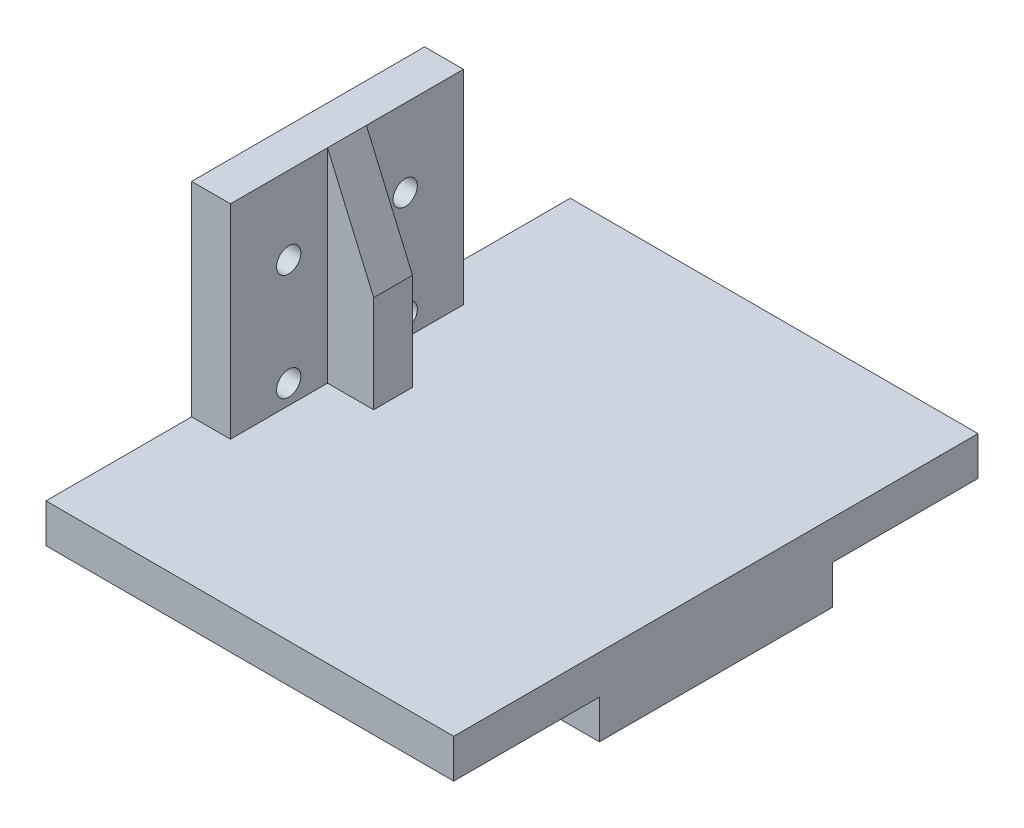
from build123d import *

# Parameters (mm, degrees)
EXTRUDE_1_DEPTH      = 24
SKETCH_2_W           = 42
SKETCH_2_H           = 4
EXTRUDE_2_DEPTH      = 15
EXTRUDE_3_DEPTH      = 2
EXTRUDE_3_DEPTH_BACK = 2
SKETCH_5_R           = 1.25
CUT_EXTRUDE_1_DEPTH  = 62.692787261


with BuildPart() as part:
    # Эскиз1 → Бобышка-Вытянуть1 (new body)
    with BuildSketch(Plane.XY):
        Polygon((0, 0), (0, 29), (4, 29), (4, 8), (42, 8), (42, 0), align=None)
    extrude(amount=-EXTRUDE_1_DEPTH)

    # Эскиз2 → Бобышка-Вытянуть2 (add)
    with BuildSketch(Plane.XY):
        with Locations((21, 6)):
            Rectangle(SKETCH_2_W, SKETCH_2_H)
    extrude_2 = extrude(amount=EXTRUDE_2_DEPTH)

    # Зеркальное отражение1: Бобышка-Вытянуть2 across plane
    add(extrude_2.mirror(Plane.XY.offset(-12)))

    # Эскиз4 → Бобышка-Вытянуть3 (add, two sides: drawn at the far end of the back side and taken through both)
    with BuildSketch(Plane(origin=(0, 0, -12), x_dir=(0, -1, 0), z_dir=(0, 0, 1)).offset(-EXTRUDE_3_DEPTH_BACK)):
        Polygon((-8, 8.75), (-18, 8.75), (-29, 4), (-8, 4), align=None)
    extrude(amount=EXTRUDE_3_DEPTH + EXTRUDE_3_DEPTH_BACK)

    # Эскиз5 → Вырез-Вытянуть1 (cut, through all)
    with BuildSketch(Plane(origin=(4, 0, 0), x_dir=(0, 0, -1), z_dir=(1, 0, 0))):
        with Locations(Location((6, 21, 0), (0, 0, 90))):
            Circle(SKETCH_5_R)
        with Locations(Location((6, 10, 0), (0, 0, 90))):
            Circle(SKETCH_5_R)
        with Locations(Location((18, 10, 0), (0, 0, 90))):
            Circle(SKETCH_5_R)
        with Locations(Location((18, 21, 0), (0, 0, 90))):
            Circle(SKETCH_5_R)
    extrude(amount=-CUT_EXTRUDE_1_DEPTH, mode=Mode.SUBTRACT)


solid = part.part
